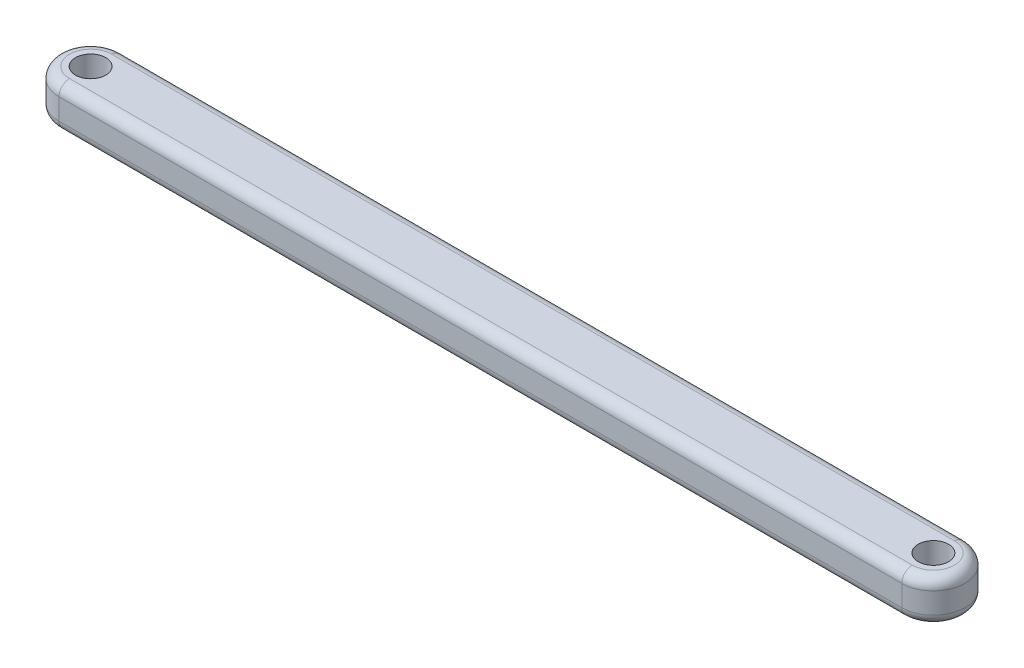
from build123d import *

# Parameters (mm, degrees)
BOSS_EXTRUDE1_DEPTH = 3.175
SKETCH2_R           = 2.286
CUT_EXTRUDE1_DEPTH  = 133.001364813
FILLET1_R           = 1.5875


with BuildPart() as part:
    # Sketch1 → Boss-Extrude1 (new, symmetric)
    with BuildSketch(Plane(origin=(0, 0, 0), x_dir=(1, 0, 0), z_dir=(0, 1, 0))):
        with BuildLine():
            Line((0, 4.7625), (127, 4.7625))
            ThreePointArc((127, 4.7625), (131.7625, 0), (127, -4.7625))
            Line((127, -4.7625), (0, -4.7625))
            ThreePointArc((0, -4.7625), (-4.7625, 0), (0, 4.7625))
        make_face()
    extrude(amount=BOSS_EXTRUDE1_DEPTH, both=True)

    # Sketch2 → Cut-Extrude1 (cut, through all)
    with BuildSketch(Plane(origin=(0, 3.175, 0), x_dir=(1, 0, 0), z_dir=(0, 1, 0))):
        with Locations(Location((0, 0, 0), (0, 0, 270))):
            Circle(SKETCH2_R)
        with Locations(Location((127, 0, 0), (0, 0, 270))):
            Circle(SKETCH2_R)
    extrude(amount=-CUT_EXTRUDE1_DEPTH, mode=Mode.SUBTRACT)

    # Fillet1
    fillet1_edges = [part.edges().sort_by_distance(p)[0] for p in [
        (131.7625, 3.175, 0),
        (63.5, 3.175, -4.7625),
        (-4.7625, 3.175, 0),
        (63.5, -3.175, -4.7625),
        (131.7625, -3.175, 0),
        (63.5, -3.175, 4.7625),
        (-4.7625, -3.175, 0),
        (63.5, 3.175, 4.7625),
    ]]
    fillet(fillet1_edges, radius=FILLET1_R)


solid = part.part
